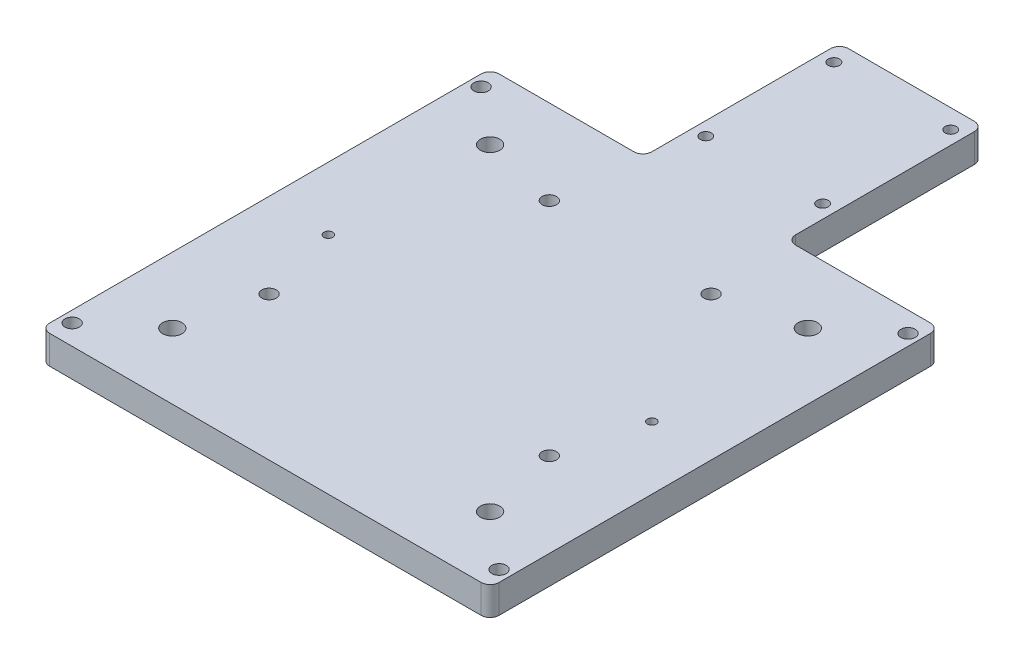
from build123d import *

# Parameters (mm, degrees)
SKETCH1_W             = 100
SKETCH1_H             = 100
BOSS_EXTRUDE1_DEPTH   = 6.35
SKETCH10_W            = 32
SKETCH10_H            = 43.75
BOSS_EXTRUDE2_DEPTH   = 6.35
SKETCH3_R             = 0.99187
CUT_EXTRUDE1_DEPTH    = 107.439583802
M3_CLEARANCE_HOLE1_D  = 3.2
M4_CLEARANCE_HOLE1_D  = 4.3
M3X0_5_TAPPED_HOLE1_D = 2.5
FILLET1_R             = 2


with BuildPart() as part:
    # Sketch1 → Boss-Extrude1 (new body)
    with BuildSketch(Plane(origin=(0, 0, 0), x_dir=(1, 0, 0), z_dir=(0, 1, 0))):
        Rectangle(SKETCH1_W, SKETCH1_H)
    extrude(amount=BOSS_EXTRUDE1_DEPTH)

    # Sketch10 → Boss-Extrude2 (add)
    with BuildSketch(Plane(origin=(0, 6.35, 0), x_dir=(1, 0, 0), z_dir=(0, 1, 0))):
        with Locations((0, 71.875)):
            Rectangle(SKETCH10_W, SKETCH10_H)
    extrude(amount=-BOSS_EXTRUDE2_DEPTH)

    # Sketch3 → Cut-Extrude1 (cut, through all)
    with BuildSketch(Plane(origin=(0, 6.35, 0), x_dir=(1, 0, 0), z_dir=(0, 1, 0))):
        with Locations(Location((-36, 0, 0), (0, 0, 270))):
            Circle(SKETCH3_R)
        with Locations(Location((36, 0, 0), (0, 0, 270))):
            Circle(SKETCH3_R)
    extrude(amount=-CUT_EXTRUDE1_DEPTH, mode=Mode.SUBTRACT)

    # M3 Clearance Hole1 (through all)
    with Locations(Plane(origin=(0, 6.35, 0), x_dir=(1, 0, 0), z_dir=(0, 1, 0))):
        with Locations((-47.5, 45.5), (47.5, 45.5), (47.5, -45.5), (-47.5, -45.5), (-31.176914536, -18), (31.176914536, -18), (18, 31.176914536), (-18, 31.176914536)):
            Hole(M3_CLEARANCE_HOLE1_D / 2)

    # M4 Clearance Hole1 (through all)
    with Locations(Plane(origin=(0, 6.35, 0), x_dir=(1, 0, 0), z_dir=(0, 1, 0))):
        with Locations((-35.355, -35.355), (-35.355, 35.355), (35.355, 35.355), (35.355, -35.355)):
            Hole(M4_CLEARANCE_HOLE1_D / 2)

    # M3x0.5 Tapped Hole1 (through all)
    with Locations(Plane(origin=(0, 6.35, 0), x_dir=(1, 0, 0), z_dir=(0, 1, 0))):
        with Locations((-13, 89.5), (13, 89.5), (13, 61), (-13, 61)):
            Hole(M3X0_5_TAPPED_HOLE1_D / 2)

    # Fillet1
    fillet1_edges = [part.edges().sort_by_distance(p)[0] for p in [
        (16, 3.175, -93.75),
        (-16, 3.175, -93.75),
        (-16, 3.175, -50),
        (16, 3.175, -50),
        (50, 3.175, 50),
        (-50, 3.175, 50),
        (-50, 3.175, -50),
        (50, 3.175, -50),
    ]]
    fillet(fillet1_edges, radius=FILLET1_R)


solid = part.part
